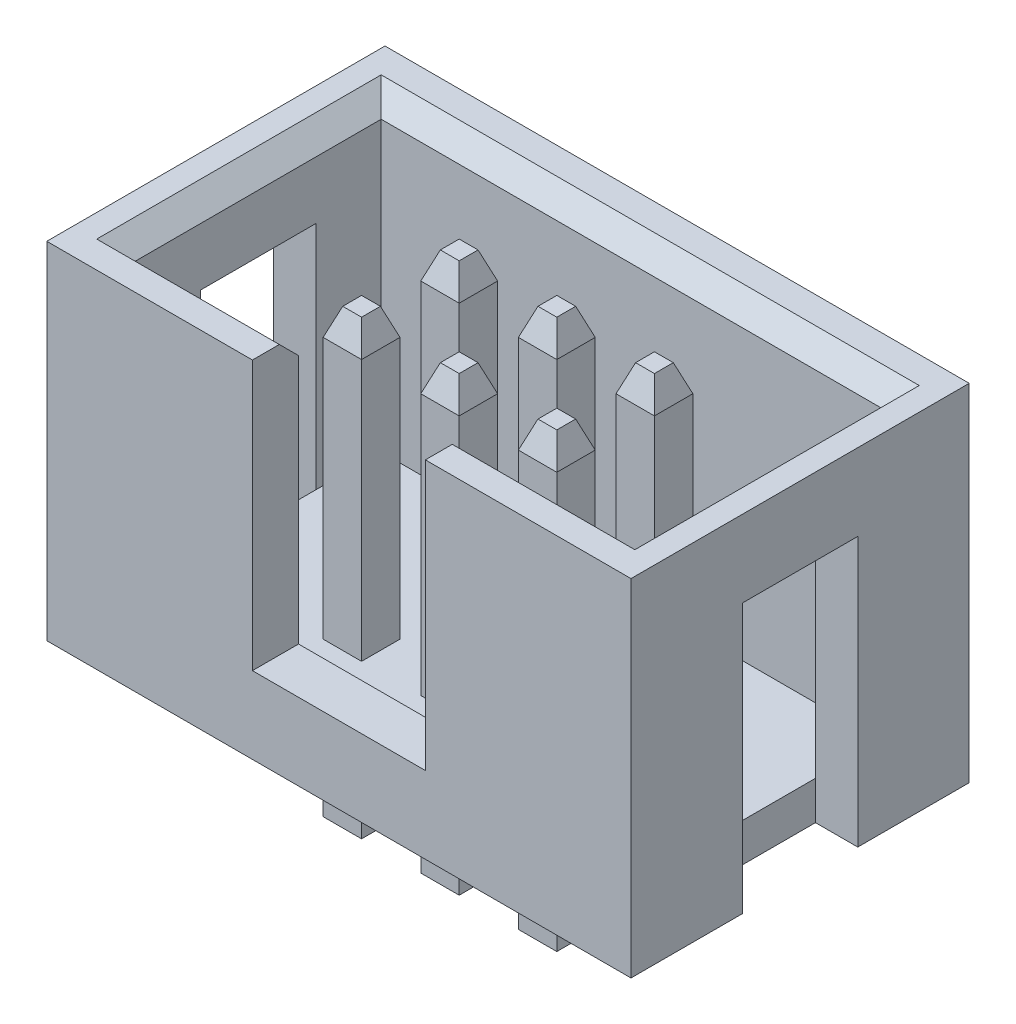
from build123d import *
from OCP.BRepFilletAPI import BRepFilletAPI_MakeChamfer

# Parameters (mm, degrees)
SKETCH1_W                = 15.2
SKETCH1_H                = 8.8
BOSS_EXTRUDE1_DEPTH      = 9
SKETCH3_W                = 13
SKETCH3_H                = 6.4
CUT_EXTRUDE1_DEPTH       = 8
SKETCH4_W                = 4.5
SKETCH4_H                = 1.2
CUT_EXTRUDE2_DEPTH       = 7
SKETCH5_W                = 3
SKETCH5_H                = 7
CUT_EXTRUDE3_DEPTH       = 1.1
SKETCH6_W                = 3
SKETCH6_H                = 7
CUT_EXTRUDE4_DEPTH       = 1.1
BOSS_EXTRUDE2_DEPTH      = 7.5
BOSS_EXTRUDE2_DEPTH_BACK = 4
SKETCH7_W                = 1
SKETCH7_H                = 1
CHAMFER1_SIZE            = 0.7
CHAMFER1_SIZE2           = 0.254779164
CHAMFER2_SIZE            = 0.5


with BuildPart() as part:
    # Sketch1 → Boss-Extrude1 (new body)
    with BuildSketch(Plane(origin=(0, 0, 0), x_dir=(1, 0, 0), z_dir=(0, 1, 0))):
        with Locations((7.6, 4.4)):
            Rectangle(SKETCH1_W, SKETCH1_H)
    extrude(amount=BOSS_EXTRUDE1_DEPTH)

    # Sketch3 → Cut-Extrude1 (cut)
    with BuildSketch(Plane(origin=(0, 9, 0), x_dir=(1, 0, 0), z_dir=(0, 1, 0))):
        with Locations((7.6, 4.4)):
            Rectangle(SKETCH3_W, SKETCH3_H)
    extrude(amount=-CUT_EXTRUDE1_DEPTH, mode=Mode.SUBTRACT)

    # Sketch4 → Cut-Extrude2 (cut)
    with BuildSketch(Plane(origin=(0, 9, 0), x_dir=(1, 0, 0), z_dir=(0, 1, 0))):
        with Locations((7.6, 0.6)):
            Rectangle(SKETCH4_W, SKETCH4_H)
    extrude(amount=-CUT_EXTRUDE2_DEPTH, mode=Mode.SUBTRACT)

    # Sketch5 → Cut-Extrude3 (cut)
    with BuildSketch(Plane.ZY):
        with Locations((-4.4, 3.5)):
            Rectangle(SKETCH5_W, SKETCH5_H)
    extrude(amount=-CUT_EXTRUDE3_DEPTH, mode=Mode.SUBTRACT)

    # Sketch6 → Cut-Extrude4 (cut)
    with BuildSketch(Plane(origin=(15.2, 0, 0), x_dir=(0, 0, -1), z_dir=(1, 0, 0))):
        with Locations((4.4, 3.5)):
            Rectangle(SKETCH6_W, SKETCH6_H)
    extrude(amount=-CUT_EXTRUDE4_DEPTH, mode=Mode.SUBTRACT)

    # Sketch7 → Boss-Extrude2 (add, two sides: drawn at the far end of the back side and taken through both)
    with BuildSketch(Plane(origin=(0, 1, 0), x_dir=(1, 0, 0), z_dir=(0, 1, 0)).offset(-BOSS_EXTRUDE2_DEPTH_BACK)):
        with Locations((7.6, 5.67)):
            Rectangle(SKETCH7_W, SKETCH7_H)
        with Locations((5.06, 5.67)):
            Rectangle(SKETCH7_W, SKETCH7_H)
        with Locations((10.14, 5.67)):
            Rectangle(SKETCH7_W, SKETCH7_H)
        with Locations((7.6, 3.13)):
            Rectangle(SKETCH7_W, SKETCH7_H)
        with Locations((10.14, 3.13)):
            Rectangle(SKETCH7_W, SKETCH7_H)
        with Locations((5.06, 3.13)):
            Rectangle(SKETCH7_W, SKETCH7_H)
    extrude(amount=BOSS_EXTRUDE2_DEPTH + BOSS_EXTRUDE2_DEPTH_BACK)

    # Chamfer1: one chamfer whose edges measure the first distance from different faces: ONE call of the kernel's chamfer builder (chamfer() names one face for all edges)
    chamfer1_edges_1 = [part.edges().sort_by_distance(p)[0] for p in [
        (7.1, 8.5, -5.67),
    ]]
    chamfer1_side_1 = [part.faces().sort_by_distance(p)[0] for p in [
        (7.1, 4.75, -5.67),
    ]]
    chamfer1_edges_2 = [part.edges().sort_by_distance(p)[0] for p in [
        (7.6, 8.5, -5.17),
    ]]
    chamfer1_side_2 = [part.faces().sort_by_distance(p)[0] for p in [
        (7.6, 4.75, -5.17),
    ]]
    chamfer1_edges_3 = [part.edges().sort_by_distance(p)[0] for p in [
        (8.1, 8.5, -5.67),
    ]]
    chamfer1_side_3 = [part.faces().sort_by_distance(p)[0] for p in [
        (8.1, 4.75, -5.67),
    ]]
    chamfer1_edges_4 = [part.edges().sort_by_distance(p)[0] for p in [
        (7.6, 8.5, -6.17),
    ]]
    chamfer1_side_4 = [part.faces().sort_by_distance(p)[0] for p in [
        (7.6, 4.75, -6.17),
    ]]
    chamfer1_edges_5 = [part.edges().sort_by_distance(p)[0] for p in [
        (9.64, 8.5, -5.67),
    ]]
    chamfer1_side_5 = [part.faces().sort_by_distance(p)[0] for p in [
        (9.64, 4.75, -5.67),
    ]]
    chamfer1_edges_6 = [part.edges().sort_by_distance(p)[0] for p in [
        (10.14, 8.5, -5.17),
    ]]
    chamfer1_side_6 = [part.faces().sort_by_distance(p)[0] for p in [
        (10.14, 4.75, -5.17),
    ]]
    chamfer1_edges_7 = [part.edges().sort_by_distance(p)[0] for p in [
        (10.64, 8.5, -5.67),
    ]]
    chamfer1_side_7 = [part.faces().sort_by_distance(p)[0] for p in [
        (10.64, 4.75, -5.67),
    ]]
    chamfer1_edges_8 = [part.edges().sort_by_distance(p)[0] for p in [
        (10.14, 8.5, -6.17),
    ]]
    chamfer1_side_8 = [part.faces().sort_by_distance(p)[0] for p in [
        (10.14, 4.75, -6.17),
    ]]
    chamfer1_edges_9 = [part.edges().sort_by_distance(p)[0] for p in [
        (7.1, 8.5, -3.13),
    ]]
    chamfer1_side_9 = [part.faces().sort_by_distance(p)[0] for p in [
        (7.1, 4.75, -3.13),
    ]]
    chamfer1_edges_10 = [part.edges().sort_by_distance(p)[0] for p in [
        (7.6, 8.5, -2.63),
    ]]
    chamfer1_side_10 = [part.faces().sort_by_distance(p)[0] for p in [
        (7.6, 4.75, -2.63),
    ]]
    chamfer1_edges_11 = [part.edges().sort_by_distance(p)[0] for p in [
        (8.1, 8.5, -3.13),
    ]]
    chamfer1_side_11 = [part.faces().sort_by_distance(p)[0] for p in [
        (8.1, 4.75, -3.13),
    ]]
    chamfer1_edges_12 = [part.edges().sort_by_distance(p)[0] for p in [
        (7.6, 8.5, -3.63),
    ]]
    chamfer1_side_12 = [part.faces().sort_by_distance(p)[0] for p in [
        (7.6, 4.75, -3.63),
    ]]
    chamfer1_edges_13 = [part.edges().sort_by_distance(p)[0] for p in [
        (9.64, 8.5, -3.13),
    ]]
    chamfer1_side_13 = [part.faces().sort_by_distance(p)[0] for p in [
        (9.64, 4.75, -3.13),
    ]]
    chamfer1_edges_14 = [part.edges().sort_by_distance(p)[0] for p in [
        (10.14, 8.5, -2.63),
    ]]
    chamfer1_side_14 = [part.faces().sort_by_distance(p)[0] for p in [
        (10.14, 4.75, -2.63),
    ]]
    chamfer1_edges_15 = [part.edges().sort_by_distance(p)[0] for p in [
        (10.64, 8.5, -3.13),
    ]]
    chamfer1_side_15 = [part.faces().sort_by_distance(p)[0] for p in [
        (10.64, 4.75, -3.13),
    ]]
    chamfer1_edges_16 = [part.edges().sort_by_distance(p)[0] for p in [
        (10.14, 8.5, -3.63),
    ]]
    chamfer1_side_16 = [part.faces().sort_by_distance(p)[0] for p in [
        (10.14, 4.75, -3.63),
    ]]
    chamfer1_edges_17 = [part.edges().sort_by_distance(p)[0] for p in [
        (4.56, 8.5, -3.13),
    ]]
    chamfer1_side_17 = [part.faces().sort_by_distance(p)[0] for p in [
        (4.56, 4.75, -3.13),
    ]]
    chamfer1_edges_18 = [part.edges().sort_by_distance(p)[0] for p in [
        (5.06, 8.5, -2.63),
    ]]
    chamfer1_side_18 = [part.faces().sort_by_distance(p)[0] for p in [
        (5.06, 4.75, -2.63),
    ]]
    chamfer1_edges_19 = [part.edges().sort_by_distance(p)[0] for p in [
        (5.56, 8.5, -3.13),
    ]]
    chamfer1_side_19 = [part.faces().sort_by_distance(p)[0] for p in [
        (5.56, 4.75, -3.13),
    ]]
    chamfer1_edges_20 = [part.edges().sort_by_distance(p)[0] for p in [
        (5.06, 8.5, -3.63),
    ]]
    chamfer1_side_20 = [part.faces().sort_by_distance(p)[0] for p in [
        (5.06, 4.75, -3.63),
    ]]
    chamfer1_edges_21 = [part.edges().sort_by_distance(p)[0] for p in [
        (4.56, 8.5, -5.67),
    ]]
    chamfer1_side_21 = [part.faces().sort_by_distance(p)[0] for p in [
        (4.56, 4.75, -5.67),
    ]]
    chamfer1_edges_22 = [part.edges().sort_by_distance(p)[0] for p in [
        (5.06, 8.5, -5.17),
    ]]
    chamfer1_side_22 = [part.faces().sort_by_distance(p)[0] for p in [
        (5.06, 4.75, -5.17),
    ]]
    chamfer1_edges_23 = [part.edges().sort_by_distance(p)[0] for p in [
        (5.56, 8.5, -5.67),
    ]]
    chamfer1_side_23 = [part.faces().sort_by_distance(p)[0] for p in [
        (5.56, 4.75, -5.67),
    ]]
    chamfer1_edges_24 = [part.edges().sort_by_distance(p)[0] for p in [
        (5.06, 8.5, -6.17),
    ]]
    chamfer1_side_24 = [part.faces().sort_by_distance(p)[0] for p in [
        (5.06, 4.75, -6.17),
    ]]
    chamfer1 = BRepFilletAPI_MakeChamfer(part.part.solid().wrapped)
    for e in chamfer1_edges_1:
        chamfer1.Add(CHAMFER1_SIZE, CHAMFER1_SIZE2, e.wrapped, chamfer1_side_1[0].wrapped)  # the first distance lies on this face
    for e in chamfer1_edges_2:
        chamfer1.Add(CHAMFER1_SIZE, CHAMFER1_SIZE2, e.wrapped, chamfer1_side_2[0].wrapped)  # the first distance lies on this face
    for e in chamfer1_edges_3:
        chamfer1.Add(CHAMFER1_SIZE, CHAMFER1_SIZE2, e.wrapped, chamfer1_side_3[0].wrapped)  # the first distance lies on this face
    for e in chamfer1_edges_4:
        chamfer1.Add(CHAMFER1_SIZE, CHAMFER1_SIZE2, e.wrapped, chamfer1_side_4[0].wrapped)  # the first distance lies on this face
    for e in chamfer1_edges_5:
        chamfer1.Add(CHAMFER1_SIZE, CHAMFER1_SIZE2, e.wrapped, chamfer1_side_5[0].wrapped)  # the first distance lies on this face
    for e in chamfer1_edges_6:
        chamfer1.Add(CHAMFER1_SIZE, CHAMFER1_SIZE2, e.wrapped, chamfer1_side_6[0].wrapped)  # the first distance lies on this face
    for e in chamfer1_edges_7:
        chamfer1.Add(CHAMFER1_SIZE, CHAMFER1_SIZE2, e.wrapped, chamfer1_side_7[0].wrapped)  # the first distance lies on this face
    for e in chamfer1_edges_8:
        chamfer1.Add(CHAMFER1_SIZE, CHAMFER1_SIZE2, e.wrapped, chamfer1_side_8[0].wrapped)  # the first distance lies on this face
    for e in chamfer1_edges_9:
        chamfer1.Add(CHAMFER1_SIZE, CHAMFER1_SIZE2, e.wrapped, chamfer1_side_9[0].wrapped)  # the first distance lies on this face
    for e in chamfer1_edges_10:
        chamfer1.Add(CHAMFER1_SIZE, CHAMFER1_SIZE2, e.wrapped, chamfer1_side_10[0].wrapped)  # the first distance lies on this face
    for e in chamfer1_edges_11:
        chamfer1.Add(CHAMFER1_SIZE, CHAMFER1_SIZE2, e.wrapped, chamfer1_side_11[0].wrapped)  # the first distance lies on this face
    for e in chamfer1_edges_12:
        chamfer1.Add(CHAMFER1_SIZE, CHAMFER1_SIZE2, e.wrapped, chamfer1_side_12[0].wrapped)  # the first distance lies on this face
    for e in chamfer1_edges_13:
        chamfer1.Add(CHAMFER1_SIZE, CHAMFER1_SIZE2, e.wrapped, chamfer1_side_13[0].wrapped)  # the first distance lies on this face
    for e in chamfer1_edges_14:
        chamfer1.Add(CHAMFER1_SIZE, CHAMFER1_SIZE2, e.wrapped, chamfer1_side_14[0].wrapped)  # the first distance lies on this face
    for e in chamfer1_edges_15:
        chamfer1.Add(CHAMFER1_SIZE, CHAMFER1_SIZE2, e.wrapped, chamfer1_side_15[0].wrapped)  # the first distance lies on this face
    for e in chamfer1_edges_16:
        chamfer1.Add(CHAMFER1_SIZE, CHAMFER1_SIZE2, e.wrapped, chamfer1_side_16[0].wrapped)  # the first distance lies on this face
    for e in chamfer1_edges_17:
        chamfer1.Add(CHAMFER1_SIZE, CHAMFER1_SIZE2, e.wrapped, chamfer1_side_17[0].wrapped)  # the first distance lies on this face
    for e in chamfer1_edges_18:
        chamfer1.Add(CHAMFER1_SIZE, CHAMFER1_SIZE2, e.wrapped, chamfer1_side_18[0].wrapped)  # the first distance lies on this face
    for e in chamfer1_edges_19:
        chamfer1.Add(CHAMFER1_SIZE, CHAMFER1_SIZE2, e.wrapped, chamfer1_side_19[0].wrapped)  # the first distance lies on this face
    for e in chamfer1_edges_20:
        chamfer1.Add(CHAMFER1_SIZE, CHAMFER1_SIZE2, e.wrapped, chamfer1_side_20[0].wrapped)  # the first distance lies on this face
    for e in chamfer1_edges_21:
        chamfer1.Add(CHAMFER1_SIZE, CHAMFER1_SIZE2, e.wrapped, chamfer1_side_21[0].wrapped)  # the first distance lies on this face
    for e in chamfer1_edges_22:
        chamfer1.Add(CHAMFER1_SIZE, CHAMFER1_SIZE2, e.wrapped, chamfer1_side_22[0].wrapped)  # the first distance lies on this face
    for e in chamfer1_edges_23:
        chamfer1.Add(CHAMFER1_SIZE, CHAMFER1_SIZE2, e.wrapped, chamfer1_side_23[0].wrapped)  # the first distance lies on this face
    for e in chamfer1_edges_24:
        chamfer1.Add(CHAMFER1_SIZE, CHAMFER1_SIZE2, e.wrapped, chamfer1_side_24[0].wrapped)  # the first distance lies on this face
    add(Compound.cast(chamfer1.Shape()), mode=Mode.REPLACE)

    # Chamfer2
    chamfer2_edges = [part.edges().sort_by_distance(p)[0] for p in [
        (1.1, 9, -4.4),
        (3.225, 9, -1.2),
        (14.1, 9, -4.4),
        (7.6, 9, -7.6),
        (11.975, 9, -1.2),
    ]]
    chamfer(chamfer2_edges, length=CHAMFER2_SIZE)


solid = part.part
